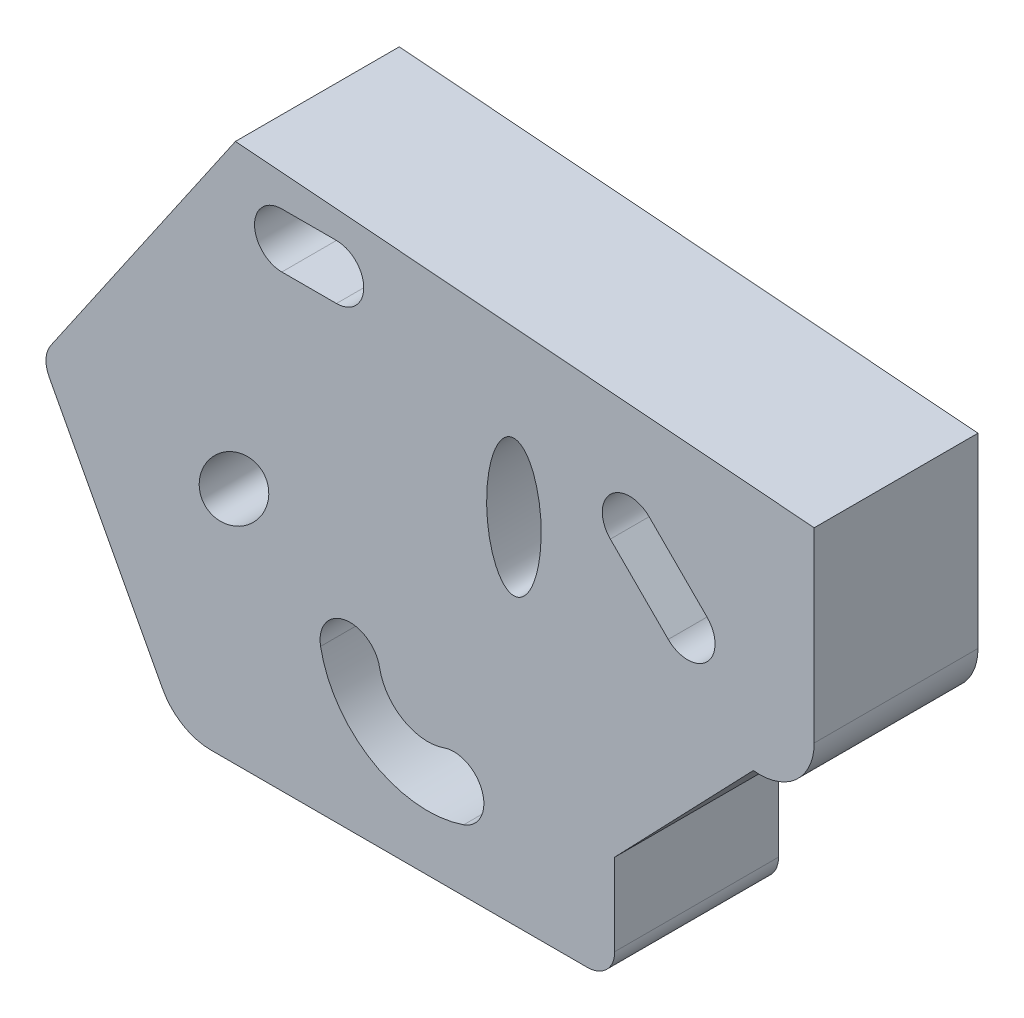
from build123d import *

# Parameters (mm, degrees)
SKETCH_3_RX     = 15
SKETCH_3_RY     = 10
SKETCH_3_RX_2   = 25
EXTRUDE_1_DEPTH = 10
SKETCH_3_3_RX   = 15
SKETCH_3_3_RY   = 10
SKETCH_3_3_RX_2 = 25
EXTRUDE_2_DEPTH = 60


with BuildPart() as part:
    # 草图3 → 凸台-拉伸1 (new body)
    with BuildSketch(Plane.XY):
        with BuildLine():
            Line((0, 0), (212, -16.559778275))
            Line((212, -16.559778275), (212, -84.849778275))
            ThreePointArc((212, -84.849778275), (205.303937337, -99.783138625), (189.699474868, -104.717027308))
            Line((189.699474868, -104.717027308), (138.935384383, -157.579407289))
            Line((138.935384383, -157.579407289), (138.935384383, -187.579407289))
            ThreePointArc((138.935384383, -187.579407289), (136.006452195, -194.650475101), (128.935384383, -197.579407289))
            Line((128.935384383, -197.579407289), (-9.047403236, -197.579407289))
            ThreePointArc((-9.047403236, -197.579407289), (-19.348164734, -194.722753304), (-26.706355093, -186.968838545))
            Line((-26.706355093, -186.968838545), (-68.22172539, -108.889782909))
            ThreePointArc((-68.22172539, -108.889782909), (-69.376331833, -103.631064432), (-67.636828751, -98.535834793))
            Line((-67.636828751, -98.535834793), (0, 0))
        make_face()
        with Locations(Location((-0.530483272, -110.497923763), (0, 0, -135))):
            Ellipse(SKETCH_3_RX, SKETCH_3_RY, mode=Mode.SUBTRACT)
        with Locations(Location((102, -68.15020742), (0, 0, 90))):
            Ellipse(SKETCH_3_RX_2, SKETCH_3_RY, mode=Mode.SUBTRACT)
        with BuildLine():
            Line((17, -12.920611137), (37, -12.920611137))
            ThreePointArc((37, -12.920611137), (47, -22.920611137), (37, -32.920611137))
            Line((37, -32.920611137), (17, -32.920611137))
            ThreePointArc((17, -32.920611137), (7, -22.920611137), (17, -12.920611137))
        make_face(mode=Mode.SUBTRACT)
        with BuildLine():
            Line((151.527534094, -43.292720139), (172.74073753, -64.505923575))
            ThreePointArc((172.74073753, -64.505923575), (172.74073753, -78.708178021), (158.538483084, -78.708178021))
            Line((158.538483084, -78.708178021), (137.325279648, -57.494974585))
            ThreePointArc((137.325279648, -57.494974585), (137.325279648, -43.292720139), (151.527534094, -43.292720139))
        make_face(mode=Mode.SUBTRACT)
        with BuildLine():
            ThreePointArc((31.188356134, -144.606315506), (50.439261207, -171.820683387), (83.625615961, -174.96472909))
            ThreePointArc((83.625615961, -174.96472909), (90.385321801, -160.953791328), (76.374384039, -154.194085489))
            ThreePointArc((76.374384039, -154.194085489), (61.462059159, -152.781305107), (52.811643866, -140.552499073))
            ThreePointArc((52.811643866, -140.552499073), (39.973091784, -131.767763424), (31.188356134, -144.606315506))
        make_face(mode=Mode.SUBTRACT)
    extrude(amount=EXTRUDE_1_DEPTH)

    # 草图3<3> → 凸台-拉伸2 (add)
    with BuildSketch(Plane.XY):
        with BuildLine():
            Line((0, 0), (212, -16.559778275))
            Line((212, -16.559778275), (212, -84.849778275))
            ThreePointArc((212, -84.849778275), (205.303937337, -99.783138625), (189.699474868, -104.717027308))
            Line((189.699474868, -104.717027308), (138.935384383, -157.579407289))
            Line((138.935384383, -157.579407289), (138.935384383, -187.579407289))
            ThreePointArc((138.935384383, -187.579407289), (136.006452195, -194.650475101), (128.935384383, -197.579407289))
            Line((128.935384383, -197.579407289), (-9.047403236, -197.579407289))
            ThreePointArc((-9.047403236, -197.579407289), (-19.348164734, -194.722753304), (-26.706355093, -186.968838545))
            Line((-26.706355093, -186.968838545), (-68.22172539, -108.889782909))
            ThreePointArc((-68.22172539, -108.889782909), (-69.376331833, -103.631064432), (-67.636828751, -98.535834793))
            Line((-67.636828751, -98.535834793), (0, 0))
        make_face()
        with Locations(Location((-0.530483272, -110.497923763), (0, 0, -135))):
            Ellipse(SKETCH_3_3_RX, SKETCH_3_3_RY, mode=Mode.SUBTRACT)
        with Locations(Location((102, -68.15020742), (0, 0, 90))):
            Ellipse(SKETCH_3_3_RX_2, SKETCH_3_3_RY, mode=Mode.SUBTRACT)
        with BuildLine():
            Line((17, -12.920611137), (37, -12.920611137))
            ThreePointArc((37, -12.920611137), (47, -22.920611137), (37, -32.920611137))
            Line((37, -32.920611137), (17, -32.920611137))
            ThreePointArc((17, -32.920611137), (7, -22.920611137), (17, -12.920611137))
        make_face(mode=Mode.SUBTRACT)
        with BuildLine():
            Line((151.527534094, -43.292720139), (172.74073753, -64.505923575))
            ThreePointArc((172.74073753, -64.505923575), (172.74073753, -78.708178021), (158.538483084, -78.708178021))
            Line((158.538483084, -78.708178021), (137.325279648, -57.494974585))
            ThreePointArc((137.325279648, -57.494974585), (137.325279648, -43.292720139), (151.527534094, -43.292720139))
        make_face(mode=Mode.SUBTRACT)
        with BuildLine():
            ThreePointArc((31.188356134, -144.606315506), (50.439261207, -171.820683387), (83.625615961, -174.96472909))
            ThreePointArc((83.625615961, -174.96472909), (90.385321801, -160.953791328), (76.374384039, -154.194085489))
            ThreePointArc((76.374384039, -154.194085489), (61.462059159, -152.781305107), (52.811643866, -140.552499073))
            ThreePointArc((52.811643866, -140.552499073), (39.973091784, -131.767763424), (31.188356134, -144.606315506))
        make_face(mode=Mode.SUBTRACT)
    extrude(amount=EXTRUDE_2_DEPTH)


solid = part.part
